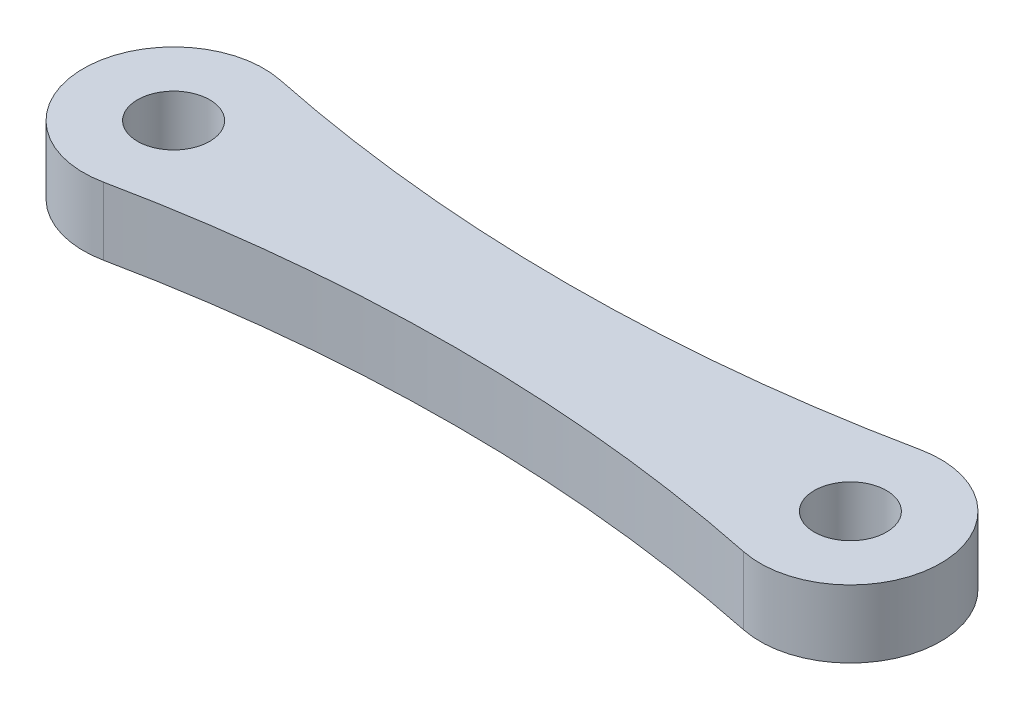
from build123d import *
from build123d.topology import SkipClean

# Parameters (mm, degrees)
SKETCH1_R           = 0.8
BOSS_EXTRUDE1_DEPTH = 1.5
SKETCH2_OUTSIDE_W   = 24.894
SKETCH2_OUTSIDE_H   = 9.894
CUT_EXTRUDE1_DEPTH  = 10.823441352


with BuildPart() as part:
    # Sketch1 → Boss-Extrude1 (new body)
    with BuildSketch(Plane(origin=(0, 0, 0), x_dir=(1, 0, 0), z_dir=(0, 1, 0))):
        with BuildLine():
            Line((-7.5, 2), (7.5, 2))
            ThreePointArc((7.5, 2), (9.5, 0), (7.5, -2))
            Line((7.5, -2), (-7.5, -2))
            ThreePointArc((-7.5, -2), (-9.5, 0), (-7.5, 2))
        make_face()
        with Locations(Location((-7.5, 0, 0), (0, 0, 270))):
            Circle(SKETCH1_R, mode=Mode.SUBTRACT)
        with Locations(Location((7.5, 0, 0), (0, 0, 270))):
            Circle(SKETCH1_R, mode=Mode.SUBTRACT)
    extrude(amount=BOSS_EXTRUDE1_DEPTH)

    # Sketch2 outside → Cut-Extrude1 (cut, through all)
    with SkipClean():  # the faces are left unmerged after this step: merging them gives an invalid solid
        with BuildSketch(Plane(origin=(0, 1.5, 0), x_dir=(1, 0, 0), z_dir=(0, 1, 0))):
            Rectangle(SKETCH2_OUTSIDE_W, SKETCH2_OUTSIDE_H)
            with BuildLine():
                ThreePointArc((-7.094594595, 1.95848065), (-9.5, 0), (-7.094594595, -1.95848065))
                ThreePointArc((-7.094594595, -1.95848065), (0, -1.231892029), (7.094594595, -1.95848065))
                ThreePointArc((7.094594595, -1.95848065), (9.5, 0), (7.094594595, 1.95848065))
                ThreePointArc((7.094594595, 1.95848065), (0, 1.231892029), (-7.094594595, 1.95848065))
            make_face(mode=Mode.SUBTRACT)
        extrude(amount=-CUT_EXTRUDE1_DEPTH, mode=Mode.SUBTRACT)


solid = part.part
